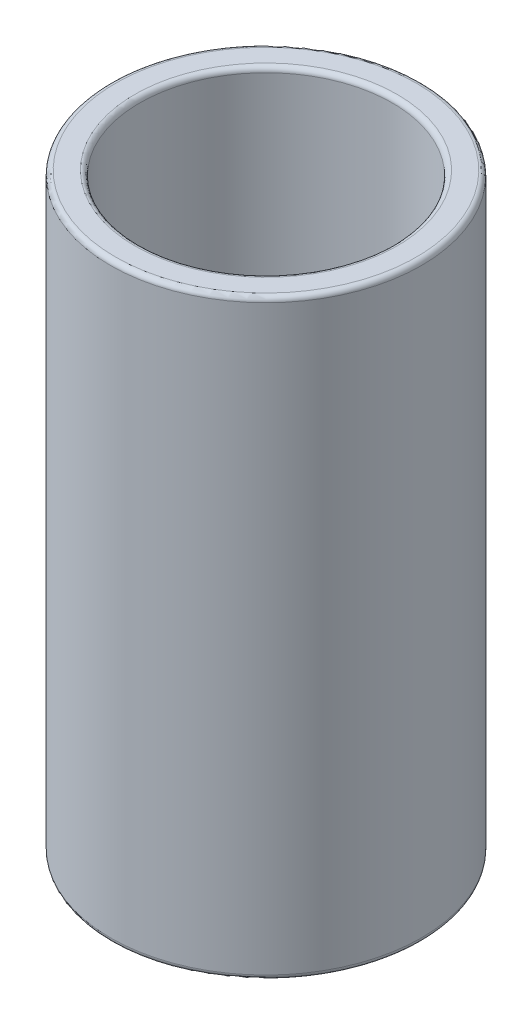
from build123d import *

# Parameters (mm, degrees)
SKETCH1_R           = 31.5
SKETCH1_R_2         = 25.6
BOSS_EXTRUDE1_DEPTH = 120
FILLET1_R           = 1


with BuildPart() as part:
    # Sketch1 → Boss-Extrude1 (new body)
    with BuildSketch(Plane(origin=(0, 0, 0), x_dir=(1, 0, 0), z_dir=(0, 1, 0))):
        with Locations(Location((0, 0, 0), (0, 0, 270))):
            Circle(SKETCH1_R)
        with Locations(Location((0, 0, 0), (0, 0, 270))):
            Circle(SKETCH1_R_2, mode=Mode.SUBTRACT)
    extrude(amount=BOSS_EXTRUDE1_DEPTH)

    # Fillet1
    fillet1_edges = [part.edges().sort_by_distance(p)[0] for p in [
        (0, 0, -31.5),
        (0, 120, -31.5),
        (0, 0, -25.6),
        (0, 120, -25.6),
    ]]
    fillet(fillet1_edges, radius=FILLET1_R)


solid = part.part
